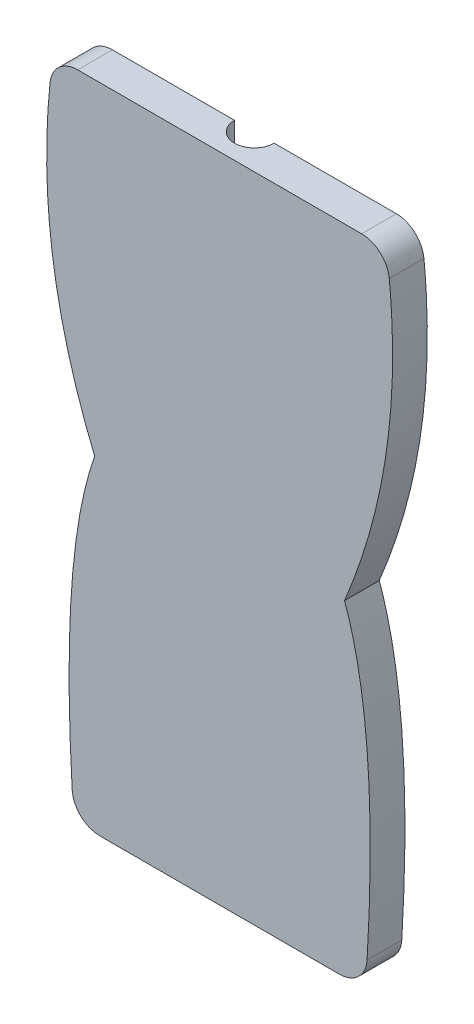
from build123d import *

# Parameters (mm, degrees)
BOSS_EXTRUDE1_DEPTH = 25
SKETCH2_R           = 14.285
CUT_EXTRUDE1_DEPTH  = 487.882938036


with BuildPart() as part:
    # Sketch1 → Boss-Extrude1 (new body)
    with BuildSketch(Plane.XY):
        with BuildLine():
            Line((0, 470), (102.304530941, 470))
            ThreePointArc((102.304530941, 470), (115.701411141, 464.850037068), (122.198947697, 452.052360092))
            add(Edge.make_bspline(
                [(122.198947697, 452.052360092), (126.05707976, 414.653812215), (124.54872054, 341.079870989), (104.591114629, 269.95223882), (90, 235)],
                knots=[0.073881588, 0.073881588, 0.073881588, 0.073881588, 0.536940794, 1, 1, 1, 1], degree=3))
            add(Edge.make_bspline(
                [(90, 235), (98.310393886, 211.902473229), (109.325776263, 152.77450372), (109.130347847, 67.78070228), (106.22993094, 18.817343576)],
                knots=[0, 0, 0, 0, 0.470365123, 0.940730246, 0.940730246, 0.940730246, 0.940730246], degree=3))
            ThreePointArc((106.22993094, 18.817343576), (99.982560761, 5.445737249), (86.264928467, 0))
            Line((86.264928467, 0), (0, 0))
            Line((0, 0), (-86.264928467, 0))
            ThreePointArc((-86.264928467, 0), (-99.982560761, 5.445737249), (-106.22993094, 18.817343576))
            add(Edge.make_bspline(
                [(-90, 235), (-98.310393886, 211.902473229), (-109.325776263, 152.77450372), (-109.130347847, 67.78070228), (-106.22993094, 18.817343576)],
                knots=[0, 0, 0, 0, 0.470365123, 0.940730246, 0.940730246, 0.940730246, 0.940730246], degree=3))
            add(Edge.make_bspline(
                [(-122.198947697, 452.052360092), (-126.05707976, 414.653812215), (-124.54872054, 341.079870989), (-104.591114629, 269.95223882), (-90, 235)],
                knots=[0.073881588, 0.073881588, 0.073881588, 0.073881588, 0.536940794, 1, 1, 1, 1], degree=3))
            ThreePointArc((-122.198947697, 452.052360092), (-115.701411141, 464.850037068), (-102.304530941, 470))
            Line((-102.304530941, 470), (0, 470))
        make_face()
    extrude(amount=BOSS_EXTRUDE1_DEPTH)

    # Sketch2 → Cut-Extrude1 (cut, through all)
    with BuildSketch(Plane(origin=(0, 0, 0), x_dir=(1, 0, 0), z_dir=(0, 1, 0))):
        Circle(SKETCH2_R)
    extrude(amount=CUT_EXTRUDE1_DEPTH, mode=Mode.SUBTRACT)


solid = part.part
